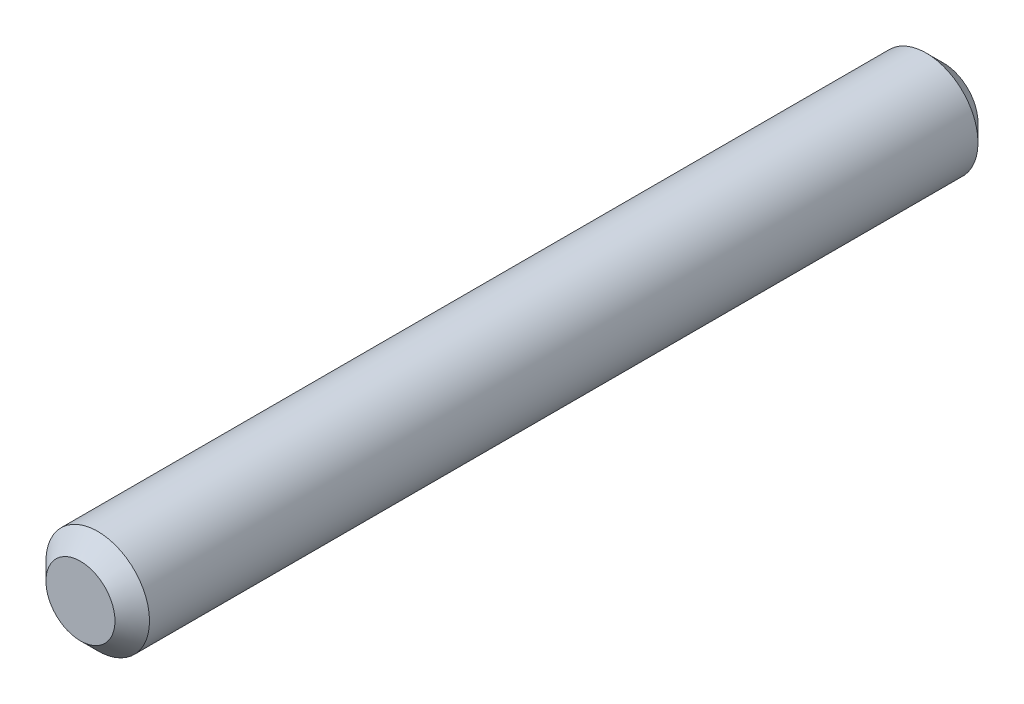
from build123d import *

# Parameters (mm, degrees)
SKETCH1_R           = 1.5
BOSS_EXTRUDE1_DEPTH = 25
CHAMFER1_SIZE       = 0.5


with BuildPart() as part:
    # Sketch1 → Boss-Extrude1 (new body)
    with BuildSketch(Plane.XY):
        Circle(SKETCH1_R)
    extrude(amount=BOSS_EXTRUDE1_DEPTH)

    # Chamfer1
    chamfer1_edges = [part.edges().sort_by_distance(p)[0] for p in [
        (-1.5, 0, 0),
        (-1.5, 0, 25),
    ]]
    chamfer(chamfer1_edges, length=CHAMFER1_SIZE)


solid = part.part
